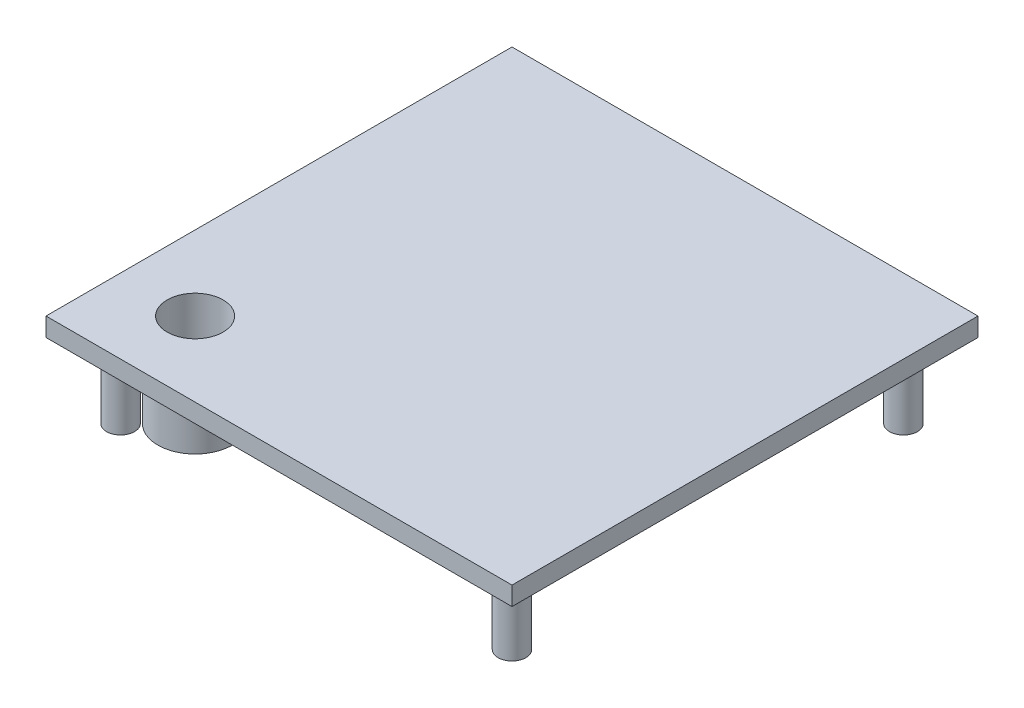
from build123d import *
from build123d.topology import SkipClean

# Parameters (mm, degrees)
SKETCH1_W           = 50
SKETCH1_H           = 50
TOP_DEPTH           = 2
CONNECTER_DEPTH     = 3
SKETCH3_R           = 0.25
CONNECTER_CUT_DEPTH = 10
BRACE_DEPTH         = 5.5
BRACE_DEPTH_BACK    = 2
SKETCH6_R           = 3
LED_CUTOUT_DEPTH    = 2
LED_START           = 7
SKETCH7_R           = 4
SKETCH7_R_2         = 3
LED_COVER_DEPTH     = 7
LED_START_2         = 8
SKETCH8_R           = 4
SKETCH8_R_2         = 2.5
LED_FASTENER_DEPTH  = 1
SKETCH9_R           = 1.5
DOWEL_JOINTS_DEPTH  = 8


with BuildPart() as part:
    # Sketch1 → Top (new body)
    with BuildSketch(Plane(origin=(0, 0, 0), x_dir=(1, 0, 0), z_dir=(0, 1, 0))):
        Rectangle(SKETCH1_W, SKETCH1_H)
    extrude(amount=TOP_DEPTH)

    # Sketch2 → Connecter (add)
    with BuildSketch(Plane(origin=(0, 0, 0), x_dir=(1, 0, 0), z_dir=(0, 1, 0))):
        Polygon((-0.522021456, -3.5), (0.496536082, -3.5), (1.112257313, -3.5), (1.987257313, -3.5), (1.987257313, -5.5), (-2.012742687, -5.5), (-2.012742687, -3.5), (-1.137742687, -3.5), align=None)
    extrude(amount=-CONNECTER_DEPTH)

    # Sketch3 → Connecter Cut (cut)
    with BuildSketch(Plane.XY):
        with Locations(Location((-0.004247524, -0.999990979, 0), (0, 0, 180))):
            Circle(SKETCH3_R)
        with Locations(Location((-1.004247524, -0.999990979, 0), (0, 0, 180))):
            Circle(SKETCH3_R)
        with Locations(Location((0.995752476, -0.999990979, 0), (0, 0, 180))):
            Circle(SKETCH3_R)
    extrude(amount=CONNECTER_CUT_DEPTH, mode=Mode.SUBTRACT)

    # Sketch5 → Brace (add, two sides: drawn at the far end of the back side and taken through both)
    with BuildSketch(Plane.XY.offset(-BRACE_DEPTH_BACK)):
        Polygon((2.987257313, 0), (1.987257313, 0), (1.987257313, -2), (-0.006371344, -2), (-2.012742687, -2), (-2.012742687, 0), (-3, 0), (-3, -2.996768929), (2.987257313, -2.996768929), align=None)
    extrude(amount=BRACE_DEPTH + BRACE_DEPTH_BACK)

    # Sketch6 → LED Cutout (cut)
    with BuildSketch(Plane(origin=(0, 0, 0), x_dir=(1, 0, 0), z_dir=(0, 1, 0))):
        with Locations(Location((-17, -17, 0), (0, 0, 270))):
            Circle(SKETCH6_R)
    extrude(amount=LED_CUTOUT_DEPTH, mode=Mode.SUBTRACT)

    # Sketch7 → LED Cover (add)
    with SkipClean():  # the faces are left unmerged after this step: merging them gives an invalid solid
        with BuildSketch(Plane.XZ.offset(LED_START)):
            with Locations(Location((-17, 17, 0), (0, 0, 270))):
                Circle(SKETCH7_R)
            with Locations(Location((-17, 17, 0), (0, 0, 270))):
                Circle(SKETCH7_R_2, mode=Mode.SUBTRACT)
        extrude(amount=-LED_COVER_DEPTH)

    # Sketch8 → LED Fastener (add)
    with SkipClean():  # the faces are left unmerged after this step: merging them gives an invalid solid
        with BuildSketch(Plane.XZ.offset(LED_START_2)):
            with Locations(Location((-17, 17, 0), (0, 0, 270))):
                Circle(SKETCH8_R)
            with Locations(Location((-17, 17, 0), (0, 0, 270))):
                Circle(SKETCH8_R_2, mode=Mode.SUBTRACT)
        extrude(amount=-LED_FASTENER_DEPTH)

    # Sketch9 → Dowel Joints (add)
    with SkipClean():  # the faces are left unmerged after this step: merging them gives an invalid solid
        with BuildSketch(Plane(origin=(0, 0, 0), x_dir=(1, 0, 0), z_dir=(0, 1, 0))):
            with Locations(Location((-21, -21, 0), (0, 0, 270))):
                Circle(SKETCH9_R)
            with Locations(Location((21, -21, 0), (0, 0, 90))):
                Circle(SKETCH9_R)
            with Locations(Location((21, 21, 0), (0, 0, 270))):
                Circle(SKETCH9_R)
            with Locations(Location((-21, 21, 0), (0, 0, 90))):
                Circle(SKETCH9_R)
        extrude(amount=-DOWEL_JOINTS_DEPTH)


solid = part.part
